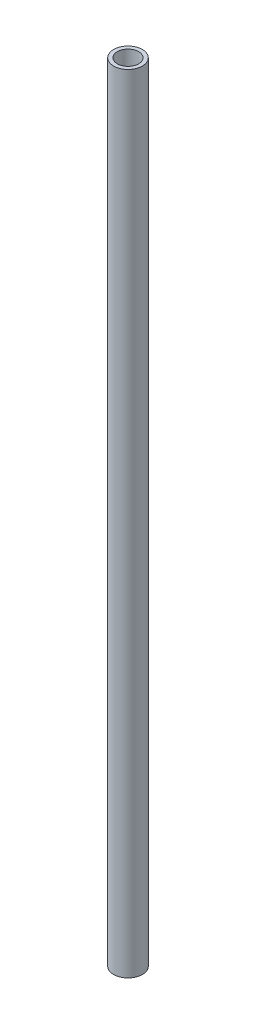
from build123d import *

# Parameters (mm, degrees)
SKETCH1_R           = 6.35
SKETCH1_R_2         = 4.699
BOSS_EXTRUDE1_DEPTH = 347.98


with BuildPart() as part:
    # Sketch1 → Boss-Extrude1 (new body)
    with BuildSketch(Plane(origin=(0, 0, 0), x_dir=(1, 0, 0), z_dir=(0, 1, 0))):
        with Locations(Location((0, 0, 0), (0, 0, 270))):
            Circle(SKETCH1_R)
        with Locations(Location((0, 0, 0), (0, 0, 270))):
            Circle(SKETCH1_R_2, mode=Mode.SUBTRACT)
    extrude(amount=BOSS_EXTRUDE1_DEPTH)


solid = part.part
